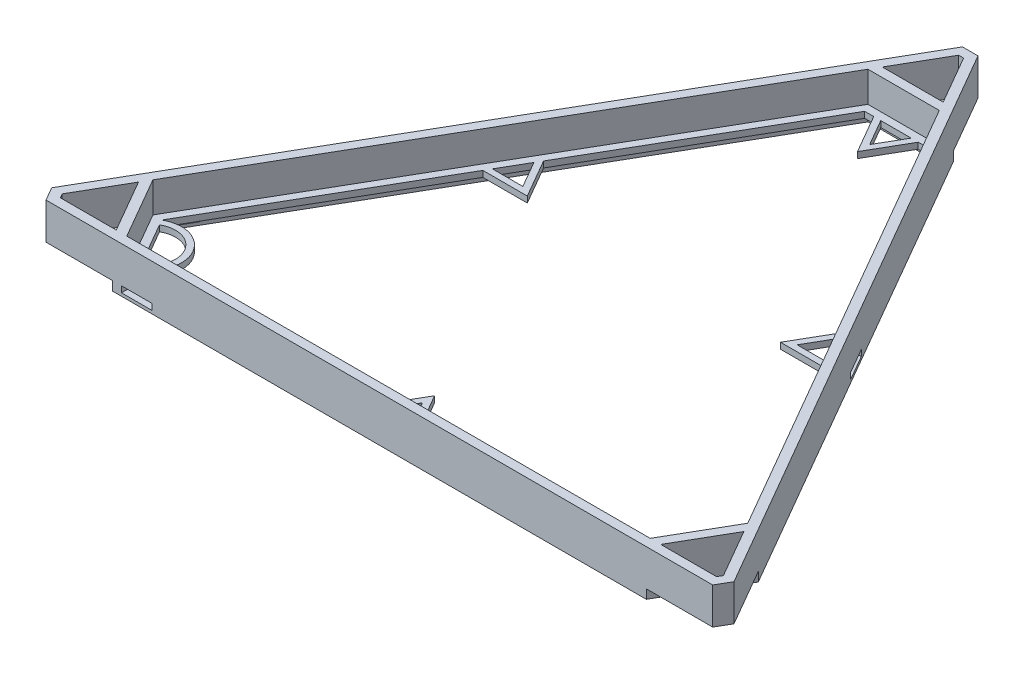
from build123d import *

# Parameters (mm, degrees)
BOSS_EXTRUDE1_DEPTH = 12
BOSS_EXTRUDE2_DEPTH = 2
BOSS_EXTRUDE3_DEPTH = 3
SKETCH4_W           = 10
SKETCH4_H           = 2
CUT_EXTRUDE1_DEPTH  = 6
SKETCH5_W           = 10
SKETCH5_H           = 2
CUT_EXTRUDE2_DEPTH  = 6
SKETCH6_W           = 10
SKETCH6_H           = 2
CUT_EXTRUDE3_DEPTH  = 6


with BuildPart() as part:
    # Sketch1 → Boss-Extrude1 (new body)
    with BuildSketch(Plane(origin=(0, 0, 0), x_dir=(1, 0, 0), z_dir=(0, 1, 0))):
        Polygon((109.556624327, -4.42820323), (-109.556624327, -4.42820323), (-112.113248654, 0), (-2.55662435, 189.757639654), (2.556624303, 189.757639654), (112.113248654, 0), align=None)
        Polygon((-107.82457352, -1.42820323), (-108.649147039, 0), (-99.473720558, 15.892304845), (-89.473720559, -1.42820323), align=None, mode=Mode.SUBTRACT)
        Polygon((-0.824573543, 186.757639627), (0.824573481, 186.757639627), (9.999999979, 170.86533478), (-10.000000021, 170.86533478), align=None, mode=Mode.SUBTRACT)
        Polygon((108.649147039, 0), (107.824573535, -1.428203221), (89.473720574, -1.428203221), (99.473720574, 15.892304855), align=None, mode=Mode.SUBTRACT)
        Polygon((-11.732050809, 167.865334805), (11.732050809, 167.865334805), (97.741669771, 18.892304864), (86.009618954, -1.428203229), (-86.009618944, -1.428203229), (-97.741669751, 18.892304845), align=None, mode=Mode.SUBTRACT)
    extrude(amount=BOSS_EXTRUDE1_DEPTH)

    # Sketch1<4> → Boss-Extrude2 (add)
    with BuildSketch(Plane(origin=(0, 0, 0), x_dir=(1, 0, 0), z_dir=(0, 1, 0))):
        Polygon((11.732050809, 167.865334805), (-11.732050809, 167.865334805), (-97.741669751, 18.892304845), (-86.009618944, -1.428203229), (86.009618954, -1.428203229), (97.741669771, 18.892304864), align=None)
        with BuildLine():
            Line((-85.566243251, 2.803847594), (-93.854918378, 17.160254041))
            ThreePointArc((-93.854918378, 17.160254041), (-82.532377591, 14.126388381), (-85.566243251, 2.803847594))
        make_face(mode=Mode.SUBTRACT)
        Polygon((-1e-08, 9.732050841), (4.99999999, 1.071796803), (-5.00000001, 1.071796803), align=None, mode=Mode.SUBTRACT)
        Polygon((-45.071796745, 87.798692801), (-55.071796745, 87.798692801), (-50.071796745, 96.458946839), align=None, mode=Mode.SUBTRACT)
        with BuildLine():
            Line((56.226497316, 85.798692796), (94.854918412, 18.892304841))
            Line((94.854918412, 18.892304841), (84.566243293, 1.071796793))
            Line((84.566243293, 1.071796793), (7.309401088, 1.071796793))
            Line((7.309401088, 1.071796793), (2e-09, 13.732050847))
            Line((2e-09, 13.732050847), (-7.309401077, 1.071796786))
            Line((-7.309401077, 1.071796786), (-84.566243251, 1.071796786))
            ThreePointArc((-84.566243251, 1.071796786), (-80.800326783, 15.126388381), (-94.854918378, 18.892304849))
            Line((-94.854918378, 18.892304849), (-56.226497283, 85.798692801))
            Line((-56.226497283, 85.798692801), (-41.60769513, 85.798692801))
            Line((-41.60769513, 85.798692801), (-48.917096207, 98.458946839))
            Line((-48.917096207, 98.458946839), (-10.288675112, 165.365334792))
            Line((-10.288675112, 165.365334792), (-7.309401077, 165.365334792))
            Line((-7.309401077, 165.365334792), (0, 152.705080754))
            Line((0, 152.705080754), (7.309401077, 165.365334792))
            Line((7.309401077, 165.365334792), (10.288675142, 165.365334792))
            Line((10.288675142, 165.365334792), (48.91709624, 98.458946834))
            Line((48.91709624, 98.458946834), (41.607695163, 85.798692796))
            Line((41.607695163, 85.798692796), (56.226497316, 85.798692796))
        make_face(mode=Mode.SUBTRACT)
        Polygon((45.071796778, 87.798692803), (50.071796778, 96.458946841), (55.071796778, 87.798692803), align=None, mode=Mode.SUBTRACT)
        Polygon((0, 156.705080761), (-5, 165.365334799), (5, 165.365334799), align=None, mode=Mode.SUBTRACT)
    extrude(amount=BOSS_EXTRUDE2_DEPTH)

    # Sketch2 → Boss-Extrude3 (add)
    with BuildSketch(Plane.XZ):
        Polygon((101.205771363, -18.892304847), (87.741669751, 4.42820323), (-87.741669751, 4.42820323), (-101.205771368, -18.892304847), (-13.464101652, -170.86533478), (13.464101609, -170.86533478), align=None)
        Polygon((-11.732050819, -167.865334802), (11.732050795, -167.865334802), (97.741669739, -18.892304852), (86.009618931, 1.42820323), (-86.009618931, 1.42820323), (-97.741669763, -18.892304852), align=None, mode=Mode.SUBTRACT)
    extrude(amount=BOSS_EXTRUDE3_DEPTH)

    # Sketch4 → Cut-Extrude1 (cut)
    with BuildSketch(Plane.XY.offset(4.42820323)):
        with Locations((-79.741669751, -1)):
            Rectangle(SKETCH4_W, SKETCH4_H)
    extrude(amount=-CUT_EXTRUDE1_DEPTH, mode=Mode.SUBTRACT)

    # Sketch5 → Cut-Extrude2 (cut)
    with BuildSketch(Plane(origin=(-84.084936503, 0, -48.546460711), x_dir=(-0.4999999998935114, 0, 0.86602540384592), z_dir=(-0.86602540384592, 0, -0.4999999998935114))):
        with Locations((26.241669739, -1)):
            Rectangle(SKETCH5_W, SKETCH5_H)
    extrude(amount=-CUT_EXTRUDE2_DEPTH, mode=Mode.SUBTRACT)

    # Sketch6 → Cut-Extrude3 (cut)
    with BuildSketch(Plane(origin=(84.084936484, 0, -48.546460721), x_dir=(-0.5000000000540236, 0, -0.8660254037532481), z_dir=(0.8660254037532481, 0, -0.5000000000540236))):
        with Locations((53.499999991, -1)):
            Rectangle(SKETCH6_W, SKETCH6_H)
    extrude(amount=-CUT_EXTRUDE3_DEPTH, mode=Mode.SUBTRACT)


solid = part.part
